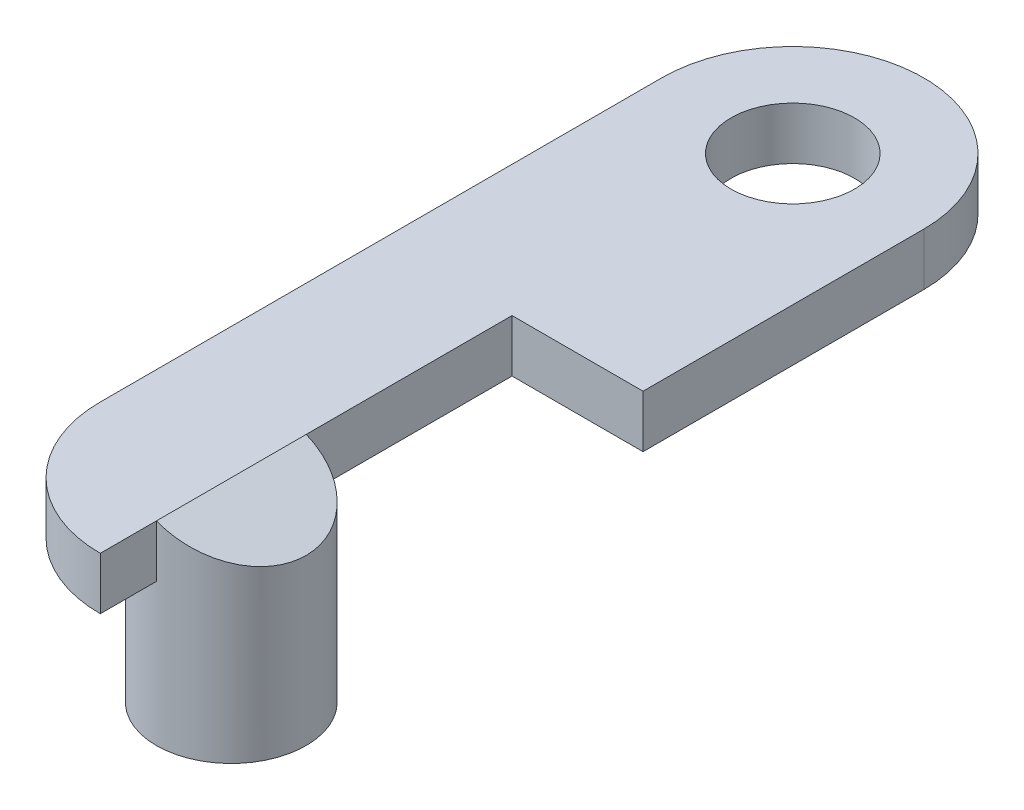
from build123d import *

# Parameters (mm, degrees)
SKETCH_1_R          = 2
EXTRUDE_1_DEPTH     = 3.8
SKETCH_2_R          = 1.65
EXTRUDE_2_DEPTH     = 1.4
CUT_EXTRUDE_1_DEPTH = 20.207810911
CUT_EXTRUDE_2_DEPTH = 13.660568708


with BuildPart() as part:
    # 草图1 → 凸台-拉伸1 (new body)
    with BuildSketch(Plane(origin=(0, 0, 0), x_dir=(1, 0, 0), z_dir=(0, 1, 0))):
        with Locations(Location((0, 0, 0), (0, 0, 90))):
            Circle(SKETCH_1_R)
    extrude(amount=EXTRUDE_1_DEPTH)

    # 草图2 → 凸台-拉伸2 (add)
    with BuildSketch(Plane(origin=(0, 3.8, 0), x_dir=(1, 0, 0), z_dir=(0, 1, 0))):
        with BuildLine():
            Line((-3.5, 0), (-3.5, 15))
            ThreePointArc((-3.5, 15), (0, 18.5), (3.5, 15))
            Line((3.5, 15), (3.5, 0))
            ThreePointArc((3.5, 0), (0, -3.5), (-3.5, 0))
        make_face()
        with Locations(Location((0, 15, 0), (0, 0, 270))):
            Circle(SKETCH_2_R, mode=Mode.SUBTRACT)
    extrude(amount=EXTRUDE_2_DEPTH)

    # 草图3 → 切除-拉伸1 (cut, through all)
    with BuildSketch(Plane.XZ.offset(-3.8)):
        with BuildLine():
            Line((0, 3.5), (0, 2))
            ThreePointArc((0, 2), (2, 0), (0, -2))
            Line((0, -2), (0, -7.5))
            Line((0, -7.5), (3.5, -7.5))
            Line((3.5, -7.5), (3.5, 0))
            ThreePointArc((3.5, 0), (2.474873734, 2.474873734), (0, 3.5))
        make_face()
    extrude(amount=-CUT_EXTRUDE_1_DEPTH, mode=Mode.SUBTRACT)

    # 草图4 → 切除-拉伸2 (cut, through all)
    with BuildSketch(Plane.XY.offset(-7.5)):
        Polygon((0, 5.2), (3.5, 3.8), (3.5, 5.2), align=None)
    extrude(amount=CUT_EXTRUDE_2_DEPTH, mode=Mode.SUBTRACT)


solid = part.part
